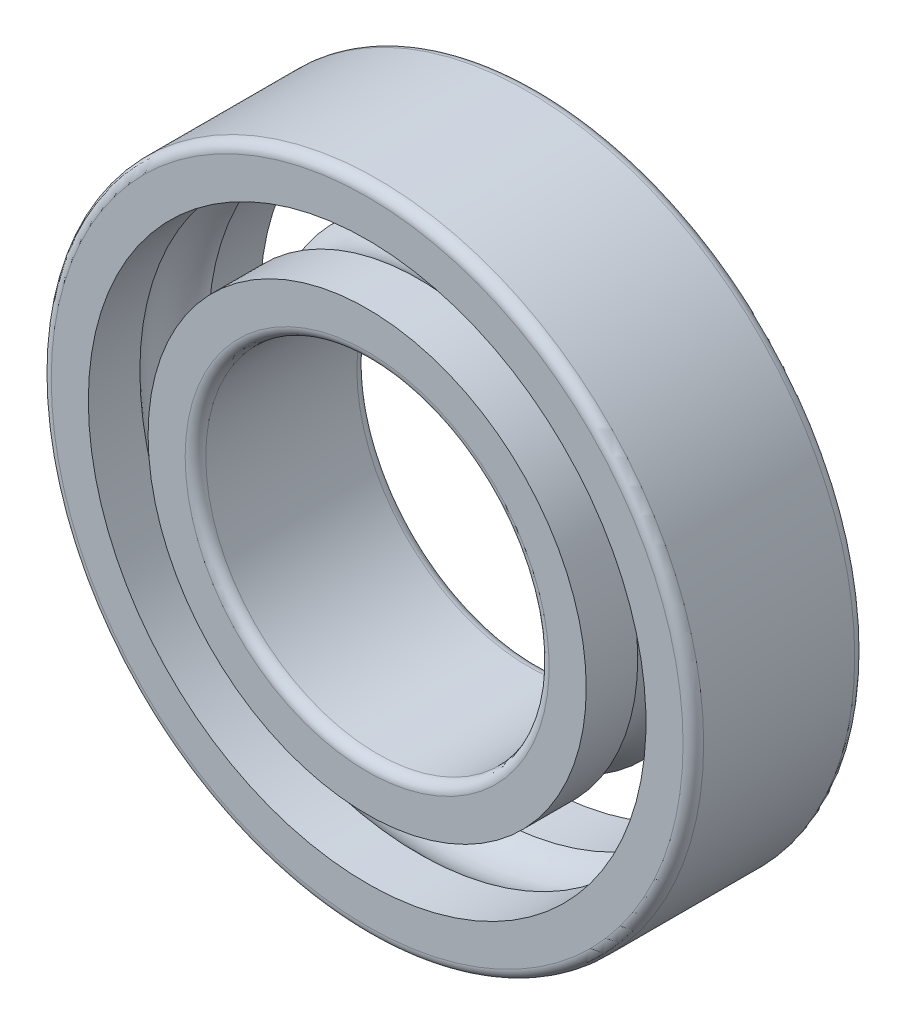
from build123d import *

# Parameters (mm, degrees)
FILLET_1_R = 0.3
FILLET_2_R = 0.3


with BuildPart() as part:
    # 草图1 → 旋转1 (revolve)
    with BuildSketch(Plane(origin=(0, 0, 0), x_dir=(1, 0, 0), z_dir=(0, 1, 0)), mode=Mode.PRIVATE) as revolve_1_sk:
        with BuildLine():
            Line((6.38, -2.5), (6.38, -0.999362297))
            ThreePointArc((6.38, -0.999362297), (5.925, 0), (6.38, 0.999362297))
            Line((6.38, 0.999362297), (6.38, 2.5))
            Line((6.38, 2.5), (5, 2.5))
            Line((5, 2.5), (5, -2.5))
            Line((5, -2.5), (6.38, -2.5))
        make_face()
        with BuildLine():
            Line((9.5, 2.5), (9.5, -2.5))
            Line((9.5, -2.5), (8.12, -2.5))
            Line((8.12, -2.5), (8.12, -0.999362297))
            ThreePointArc((8.12, -0.999362297), (8.575, 0), (8.12, 0.999362297))
            Line((8.12, 0.999362297), (8.12, 2.5))
            Line((8.12, 2.5), (9.5, 2.5))
        make_face()
    revolve(revolve_1_sk.sketch.rotate(Axis((0, 0, -11.486025173), (0, 0, 1)), 180), axis=Axis((0, 0, -11.486025173), (0, 0, 1)))

    # 圆角1
    fillet_1_edges = [part.edges().sort_by_distance(p)[0] for p in [
        (9.5, 0, -2.5),
        (9.5, 0, 2.5),
    ]]
    fillet(fillet_1_edges, radius=FILLET_1_R)

    # 圆角2
    fillet_2_edges = [part.edges().sort_by_distance(p)[0] for p in [
        (5, 0, -2.5),
        (5, 0, 2.5),
    ]]
    fillet(fillet_2_edges, radius=FILLET_2_R)


solid = part.part
